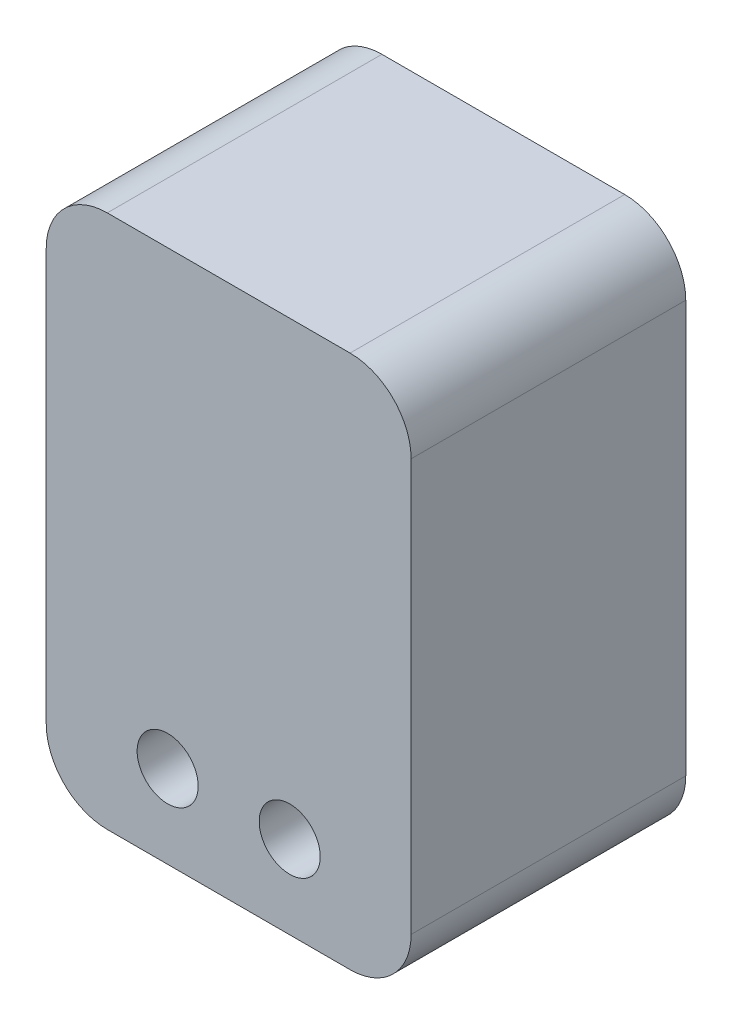
from build123d import *

# Parameters (mm, degrees)
SKETCH1_W           = 11.957581354
SKETCH1_H           = 17.5
SKETCH1_R           = 1
BOSS_EXTRUDE1_DEPTH = 9
CUT_EXTRUDE1_START  = -2
SKETCH2_R           = 3.5
CUT_EXTRUDE1_DEPTH  = 3.7
FILLET1_R           = 2


with BuildPart() as part:
    # Sketch1 → Boss-Extrude1 (new body)
    with BuildSketch(Plane.XY):
        Rectangle(SKETCH1_W, SKETCH1_H)
        with Locations((-2, -6.032367874)):
            Circle(SKETCH1_R, mode=Mode.SUBTRACT)
        with Locations((2, -6.032367874)):
            Circle(SKETCH1_R, mode=Mode.SUBTRACT)
    extrude(amount=BOSS_EXTRUDE1_DEPTH)

    # Sketch2 → Cut-Extrude1 (cut)
    with BuildSketch(Plane(origin=(0, 8.75, 0), x_dir=(1, 0, 0), z_dir=(0, 1, 0)).offset(CUT_EXTRUDE1_START)):
        with Locations(Location((0, -4.5, 0), (0, 0, 270))):
            Circle(SKETCH2_R)
    extrude(amount=-CUT_EXTRUDE1_DEPTH, mode=Mode.SUBTRACT)

    # Fillet1
    fillet1_edges = [part.edges().sort_by_distance(p)[0] for p in [
        (5.978790677, -8.75, 4.5),
        (-5.978790677, -8.75, 4.5),
        (-5.978790677, 8.75, 4.5),
        (5.978790677, 8.75, 4.5),
    ]]
    fillet(fillet1_edges, radius=FILLET1_R)


solid = part.part
